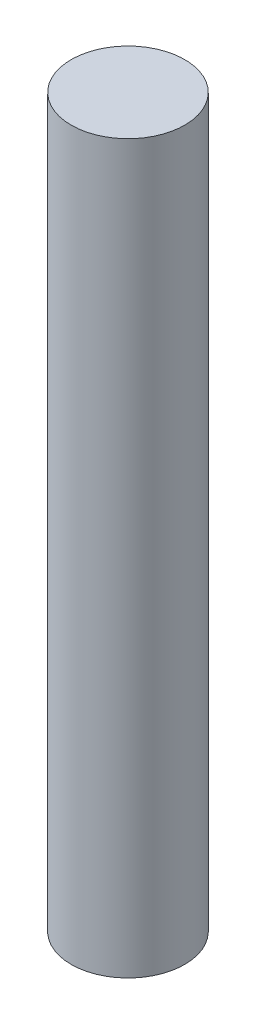
from build123d import *

# Parameters (mm, degrees)
SKETCH1_R           = 1.25
BOSS_EXTRUDE1_DEPTH = 16


with BuildPart() as part:
    # Sketch1 → Boss-Extrude1 (new body)
    with BuildSketch(Plane(origin=(0, 0, 0), x_dir=(1, 0, 0), z_dir=(0, 1, 0))):
        with Locations(Location((0, 0, 0), (0, 0, 270))):
            Circle(SKETCH1_R)
    extrude(amount=BOSS_EXTRUDE1_DEPTH)


solid = part.part
